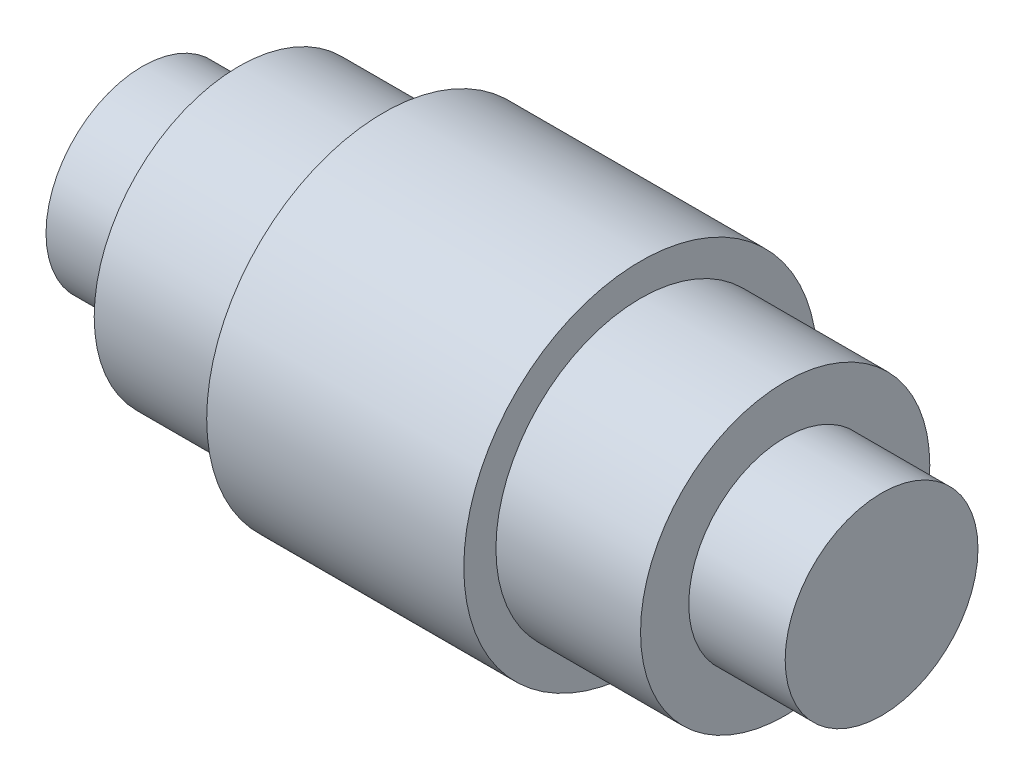
from build123d import *


with BuildPart() as part:
    # Esboço1 → Revolução1 (revolve)
    with BuildSketch(Plane.XY, mode=Mode.PRIVATE) as revolu_o1_sk:
        Polygon((0, 0), (230, 0), (230, 30), (200, 30), (200, 45), (155, 45), (155, 55), (75, 55), (75, 45), (30, 45), (30, 30), (0, 30), align=None)
    revolve(revolu_o1_sk.sketch.rotate(Axis((0, 0, 0), (1, 0, 0)), 90), axis=Axis((0, 0, 0), (1, 0, 0)))


solid = part.part
